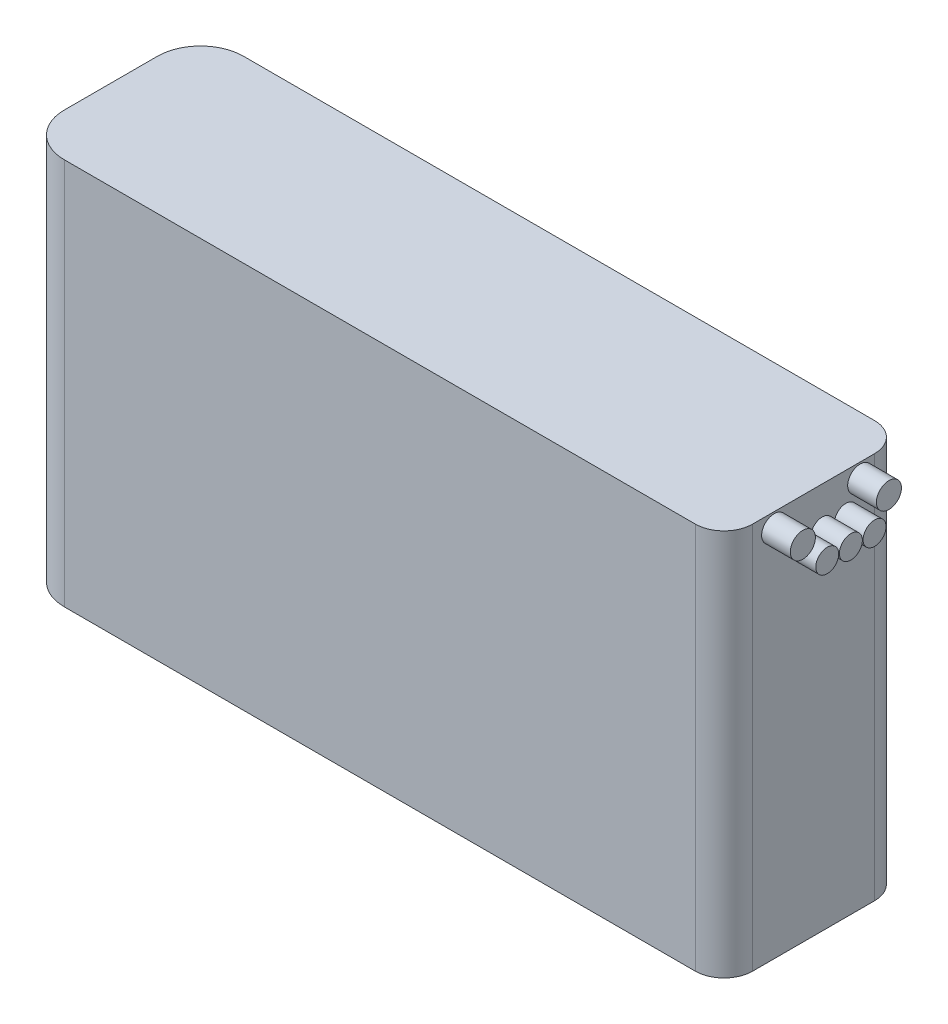
from build123d import *

# Parameters (mm, degrees)
SKIZZE1_W                       = 49
SKIZZE1_H                       = 27
AUFSATZ_LINEAR_AUSTRAGEN1_DEPTH = 12.5
VERRUNDUNG1_R                   = 2
VERRUNDUNG2_R                   = 3
SKIZZE3_R                       = 0.875
SKIZZE3_R_2                     = 0.8
AUFSATZ_LINEAR_AUSTRAGEN2_DEPTH = 2


with BuildPart() as part:
    # Skizze1 → Aufsatz-Linear austragen1 (new body)
    with BuildSketch(Plane.XY):
        with Locations((24.5, 13.5)):
            Rectangle(SKIZZE1_W, SKIZZE1_H)
    extrude(amount=AUFSATZ_LINEAR_AUSTRAGEN1_DEPTH)

    # Verrundung1
    verrundung1_edges = [part.edges().sort_by_distance(p)[0] for p in [
        (49, 13.5, 12.5),
        (49, 13.5, 0),
    ]]
    fillet(verrundung1_edges, radius=VERRUNDUNG1_R)

    # Verrundung2
    verrundung2_edges = [part.edges().sort_by_distance(p)[0] for p in [
        (0, 13.5, 12.5),
        (0, 13.5, 0),
    ]]
    fillet(verrundung2_edges, radius=VERRUNDUNG2_R)

    # Skizze3 → Aufsatz-Linear austragen2 (add)
    with BuildSketch(Plane(origin=(49, 0, 0), x_dir=(0, 0, -1), z_dir=(1, 0, 0))):
        with Locations(Location((-9, 26, 0), (0, 0, 180))):
            Circle(SKIZZE3_R)
        with Locations(Location((-3, 26, 0), (0, 0, 180))):
            Circle(SKIZZE3_R)
        with Locations(Location((-4, 24.2, 0), (0, 0, 180))):
            Circle(SKIZZE3_R_2)
        with Locations(Location((-5.65, 24.2, 0), (0, 0, 180))):
            Circle(SKIZZE3_R_2)
        with Locations(Location((-7.3, 24.2, 0), (0, 0, 180))):
            Circle(SKIZZE3_R_2)
    extrude(amount=AUFSATZ_LINEAR_AUSTRAGEN2_DEPTH)


solid = part.part
